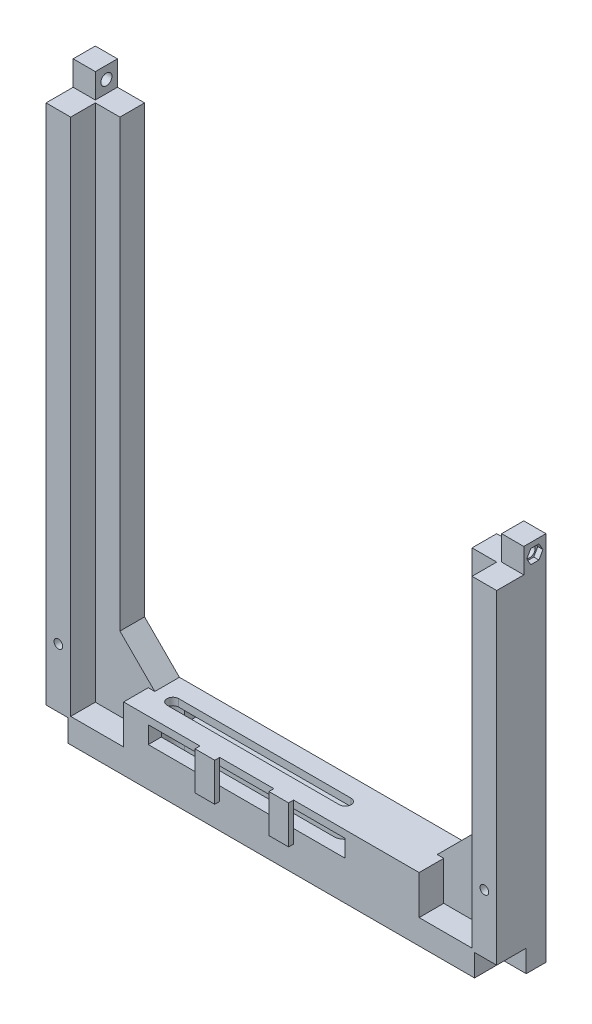
from build123d import *
from OCP.BRepFilletAPI import BRepFilletAPI_MakeChamfer

# Parameters (mm, degrees)
BOSS_EXTRUDE1_DEPTH             = 10
BOSS_EXTRUDE2_DEPTH             = 10
SKETCH3_W                       = 9
SKETCH3_H                       = 9
BOSS_EXTRUDE3_DEPTH             = 10
SKETCH5_W                       = 9
SKETCH5_H                       = 9
BOSS_EXTRUDE4_DEPTH             = 10
SKETCH6_R                       = 2.25
CUT_EXTRUDE1_DEPTH              = 9
SKETCH7_R                       = 2.25
CUT_EXTRUDE2_DEPTH              = 9
SKETCH8_R                       = 1.75
CUT_EXTRUDE3_DEPTH              = 250.05692246
CUT_EXTRUDE4_DEPTH              = 2.1
SKETCH10_W                      = 9
SKETCH10_H                      = 9
CUT_EXTRUDE5_DEPTH              = 12
SKETCH11_R                      = 1.8
CUT_EXTRUDE6_DEPTH              = 10
CHAMFER1_SIZE                   = 0.5
CHAMFER1_SIZE2                  = 1.866025404
CUT_EXTRUDE7_DEPTH              = 2.1
CUT_EXTRUDE8_DEPTH              = 2.1
SKETCH14_W                      = 120
SKETCH14_H                      = 20
BOSS_EXTRUDE5_DEPTH             = 5.84
BOSS_EXTRUDE5_DIRECTION_2_REACH = 232.648
CUT_EXTRUDE9_START              = -20
SKETCH15_W                      = 80
SKETCH15_H                      = 7
CUT_EXTRUDE9_DEPTH              = 20
CUT_EXTRUDE10_START             = -15.84
CUT_EXTRUDE10_DEPTH             = 22.84
SKETCH17_W                      = 8
SKETCH17_H                      = 15.5
BOSS_EXTRUDE6_DEPTH             = 2


with BuildPart() as part:
    # Sketch1 → Boss-Extrude1 (new body)
    with BuildSketch(Plane.XY):
        Polygon((0, 0), (-91.5, 0), (-91.5, 220.775), (-71.5, 220.775), (-71.5, 40), (-51.5, 20), (0, 20), (51.5, 20), (71.5, 40), (71.5, 140.775), (91.5, 140.775), (91.5, 0), align=None)
    extrude(amount=BOSS_EXTRUDE1_DEPTH)

    # Sketch2 → Boss-Extrude2 (add)
    with BuildSketch(Plane.XY.offset(10)):
        Polygon((-81.5, 220.775), (-91.5, 220.775), (-91.5, 0), (91.5, 0), (91.5, 140.775), (81.5, 140.775), (81.5, 10), (-81.5, 10), align=None)
    extrude(amount=BOSS_EXTRUDE2_DEPTH)

    # Sketch3 → Boss-Extrude3 (add)
    with BuildSketch(Plane(origin=(0, 220.775, 0), x_dir=(1, 0, 0), z_dir=(0, 1, 0))):
        with Locations((-87, -4.5)):
            Rectangle(SKETCH3_W, SKETCH3_H)
    extrude(amount=BOSS_EXTRUDE3_DEPTH)

    # Sketch5 → Boss-Extrude4 (add)
    with BuildSketch(Plane(origin=(0, 140.775, 0), x_dir=(1, 0, 0), z_dir=(0, 1, 0))):
        with Locations((87, -4.5)):
            Rectangle(SKETCH5_W, SKETCH5_H)
    extrude(amount=BOSS_EXTRUDE4_DEPTH)

    # Sketch6 → Cut-Extrude1 (cut)
    with BuildSketch(Plane.ZY.offset(91.5)):
        with Locations(Location((4.5, 225.775, 0), (0, 0, 270))):
            Circle(SKETCH6_R)
    extrude(amount=-CUT_EXTRUDE1_DEPTH, mode=Mode.SUBTRACT)

    # Sketch7 → Cut-Extrude2 (cut)
    with BuildSketch(Plane(origin=(91.5, 0, 0), x_dir=(0, 0, -1), z_dir=(1, 0, 0))):
        with Locations(Location((-4.5, 145.775, 0), (0, 0, 90))):
            Circle(SKETCH7_R)
    extrude(amount=-CUT_EXTRUDE2_DEPTH, mode=Mode.SUBTRACT)

    # Sketch8 → Cut-Extrude3 (cut, through all)
    with BuildSketch(Plane(origin=(0, 0, 0), x_dir=(-1, 0, 0), z_dir=(0, 0, -1))):
        with Locations((86.5, 33)):
            Circle(SKETCH8_R)
        with Locations((-86.5, 33)):
            Circle(SKETCH8_R)
    extrude(amount=-CUT_EXTRUDE3_DEPTH, mode=Mode.SUBTRACT)

    # Sketch9 → Cut-Extrude4 (cut)
    with BuildSketch(Plane(origin=(0, 0, 0), x_dir=(-1, 0, 0), z_dir=(0, 0, -1))):
        Polygon((-84.854551733, 30.15), (-83.209103466, 33), (-84.854551733, 35.85), (-88.145448267, 35.85), (-89.790896534, 33), (-88.145448267, 30.15), align=None)
        Polygon((88.145448267, 30.15), (89.790896534, 33), (88.145448267, 35.85), (84.854551733, 35.85), (83.209103466, 33), (84.854551733, 30.15), align=None)
    extrude(amount=-CUT_EXTRUDE4_DEPTH, mode=Mode.SUBTRACT)

    # Sketch10 → Cut-Extrude5 (cut)
    with BuildSketch(Plane.XY.offset(20)):
        with Locations((87, 4.5)):
            Rectangle(SKETCH10_W, SKETCH10_H)
        with Locations((-87, 4.5)):
            Rectangle(SKETCH10_W, SKETCH10_H)
    extrude(amount=-CUT_EXTRUDE5_DEPTH, mode=Mode.SUBTRACT)

    # Sketch11 → Cut-Extrude6 (cut)
    with BuildSketch(Plane.XZ.offset(-9)):
        with Locations(Location((-87, 14, 0), (0, 0, 270))):
            Circle(SKETCH11_R)
        with Locations(Location((87, 14, 0), (0, 0, 270))):
            Circle(SKETCH11_R)
    extrude(amount=-CUT_EXTRUDE6_DEPTH, mode=Mode.SUBTRACT)

    # Chamfer1: one chamfer whose edges measure the first distance from different faces: ONE call of the kernel's chamfer builder (chamfer() names one face for all edges)
    chamfer1_edges_1 = [part.edges().sort_by_distance(p)[0] for p in [
        (-87, 9, 15.8),
    ]]
    chamfer1_side_1 = [part.faces().sort_by_distance(p)[0] for p in [
        (-91.35, 9, 14),
    ]]
    chamfer1_edges_2 = [part.edges().sort_by_distance(p)[0] for p in [
        (87, 9, 15.8),
    ]]
    chamfer1_side_2 = [part.faces().sort_by_distance(p)[0] for p in [
        (82.65, 9, 14),
    ]]
    chamfer1 = BRepFilletAPI_MakeChamfer(part.part.solid().wrapped)
    for e in chamfer1_edges_1:
        chamfer1.Add(CHAMFER1_SIZE, CHAMFER1_SIZE2, e.wrapped, chamfer1_side_1[0].wrapped)  # the first distance lies on this face
    for e in chamfer1_edges_2:
        chamfer1.Add(CHAMFER1_SIZE, CHAMFER1_SIZE2, e.wrapped, chamfer1_side_2[0].wrapped)  # the first distance lies on this face
    add(Compound.cast(chamfer1.Shape()), mode=Mode.REPLACE)

    # Sketch12 → Cut-Extrude7 (cut)
    with BuildSketch(Plane.ZY.offset(91.5)):
        Polygon((6.145448267, 222.925), (7.790896534, 225.775), (6.145448267, 228.625), (2.854551733, 228.625), (1.209103466, 225.775), (2.854551733, 222.925), align=None)
    extrude(amount=-CUT_EXTRUDE7_DEPTH, mode=Mode.SUBTRACT)

    # Sketch13 → Cut-Extrude8 (cut)
    with BuildSketch(Plane(origin=(91.5, 0, 0), x_dir=(0, 0, -1), z_dir=(1, 0, 0))):
        Polygon((-2.854551733, 142.925), (-1.209103466, 145.775), (-2.854551733, 148.625), (-6.145448267, 148.625), (-7.790896534, 145.775), (-6.145448267, 142.925), align=None)
    extrude(amount=-CUT_EXTRUDE8_DEPTH, mode=Mode.SUBTRACT)

    # Sketch14 → Boss-Extrude5 (add)
    with BuildSketch(Plane(origin=(0, 20, 0), x_dir=(1, 0, 0), z_dir=(0, 1, 0))):
        with Locations((0, -10)):
            Rectangle(SKETCH14_W, SKETCH14_H)
        with BuildLine():
            Line((-50, -7.65), (20, -7.65))
            ThreePointArc((20, -7.65), (22.35, -10), (20, -12.35))
            Line((20, -12.35), (-50, -12.35))
            ThreePointArc((-50, -12.35), (-52.35, -10), (-50, -7.65))
        make_face(mode=Mode.SUBTRACT)
    extrude(amount=BOSS_EXTRUDE5_DEPTH)

    # Boss-Extrude5 direction 2: up to this face of the body (flat: up to its plane)
    boss_extrude5_direction_2_end = Plane(part.part.faces().sort_by_distance((0, 10, 15))[0])
    # Sketch14 → Boss-Extrude5 direction 2 (add, up to the picked face)
    with BuildSketch(Plane(origin=(0, 20, 0), x_dir=(1, 0, 0), z_dir=(0, 1, 0)), mode=Mode.PRIVATE) as boss_extrude5_direction_2_sk1:
        with Locations((0, -10)):
            Rectangle(SKETCH14_W, SKETCH14_H)
        with BuildLine():
            Line((-50, -7.65), (20, -7.65))
            ThreePointArc((20, -7.65), (22.35, -10), (20, -12.35))
            Line((20, -12.35), (-50, -12.35))
            ThreePointArc((-50, -12.35), (-52.35, -10), (-50, -7.65))
        make_face(mode=Mode.SUBTRACT)
    boss_extrude5_direction_2_tool1 = split(extrude(boss_extrude5_direction_2_sk1.sketch, amount=-BOSS_EXTRUDE5_DIRECTION_2_REACH, mode=Mode.PRIVATE), bisect_by=boss_extrude5_direction_2_end, keep=Keep.BOTH, mode=Mode.PRIVATE)
    add(boss_extrude5_direction_2_tool1.solids().sort_by(Axis((0, 20, 18.783447), (0, -1, 0)))[0])

    # Sketch15 → Cut-Extrude9 (cut)
    with BuildSketch(Plane(origin=(0, 0, 0), x_dir=(-1, 0, 0), z_dir=(0, 0, -1)).offset(CUT_EXTRUDE9_START)):
        with Locations((10, 19.34)):
            Rectangle(SKETCH15_W, SKETCH15_H)
    extrude(amount=CUT_EXTRUDE9_DEPTH, mode=Mode.SUBTRACT)

    # Sketch16 → Cut-Extrude10 (cut)
    with BuildSketch(Plane(origin=(0, 15.84, 0), x_dir=(1, 0, 0), z_dir=(0, 1, 0)).offset(CUT_EXTRUDE10_START)):
        with BuildLine():
            Line((20, -5.3), (-50, -5.3))
            ThreePointArc((-50, -5.3), (-54.7, -10), (-50, -14.7))
            Line((-50, -14.7), (20, -14.7))
            ThreePointArc((20, -14.7), (24.7, -10), (20, -5.3))
        make_face()
    extrude(amount=CUT_EXTRUDE10_DEPTH, mode=Mode.SUBTRACT)

    # Sketch17 → Boss-Extrude6 (add)
    with BuildSketch(Plane.XY.offset(20)):
        with Locations((-25, 18.09)):
            Rectangle(SKETCH17_W, SKETCH17_H)
        with Locations((5, 18.09)):
            Rectangle(SKETCH17_W, SKETCH17_H)
    extrude(amount=BOSS_EXTRUDE6_DEPTH)


solid = part.part
